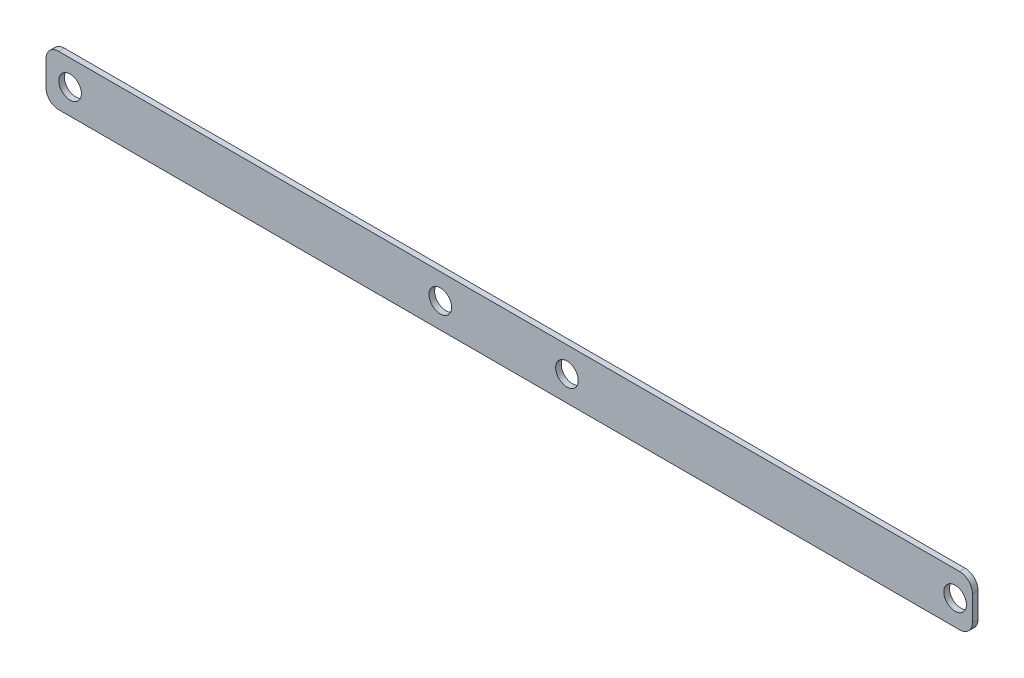
from build123d import *

# Parameters (mm, degrees)
SKETCH1_R           = 4.025
BOSS_EXTRUDE1_DEPTH = 2


with BuildPart() as part:
    # Sketch1 → Boss-Extrude1 (new body)
    with BuildSketch(Plane.XY):
        with BuildLine():
            Line((-156.117488594, 2.14041693), (164.882511406, 2.14041693))
            ThreePointArc((164.882511406, 2.14041693), (168.064491921, 0.822397445), (169.382511406, -2.35958307))
            Line((169.382511406, -2.35958307), (169.382511406, -11.35958307))
            ThreePointArc((169.382511406, -11.35958307), (168.064491921, -14.541563585), (164.882511406, -15.85958307))
            Line((164.882511406, -15.85958307), (-156.117488594, -15.85958307))
            ThreePointArc((-156.117488594, -15.85958307), (-159.299469109, -14.541563585), (-160.617488594, -11.35958307))
            Line((-160.617488594, -11.35958307), (-160.617488594, -2.35958307))
            ThreePointArc((-160.617488594, -2.35958307), (-159.299469109, 0.822397445), (-156.117488594, 2.14041693))
        make_face()
        with Locations((-20.151456561, -6.876300424)):
            Circle(SKETCH1_R, mode=Mode.SUBTRACT)
        with Locations((24.954422803, -6.882532659)):
            Circle(SKETCH1_R, mode=Mode.SUBTRACT)
        with Locations((163.241625749, -6.901639704)):
            Circle(SKETCH1_R, mode=Mode.SUBTRACT)
        with Locations((-152.036053327, -6.858078098)):
            Circle(SKETCH1_R, mode=Mode.SUBTRACT)
    extrude(amount=BOSS_EXTRUDE1_DEPTH)


solid = part.part
